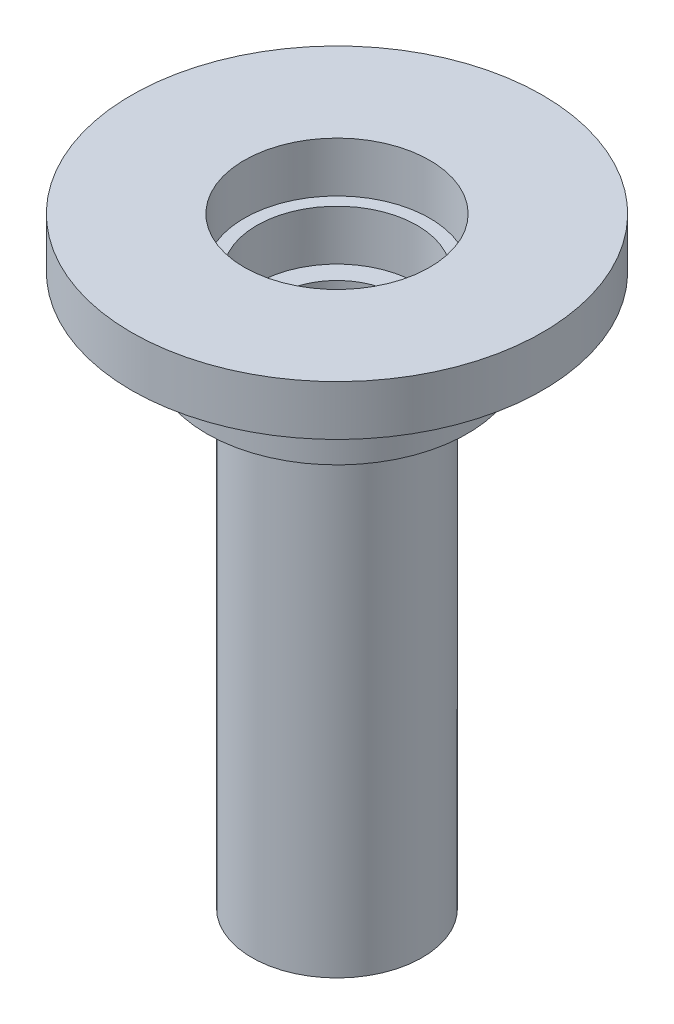
from build123d import *

# Parameters (mm, degrees)
SKETCH3_R      = 18.5
EXTRUDE1_DEPTH = 20
SKETCH4_R      = 14
EXTRUDE2_DEPTH = 14
SKETCH5_R      = 18.5
EXTRUDE3_DEPTH = 10


with BuildPart() as part:
    # Sketch2 → Revolve1 (revolve)
    with BuildSketch(Plane.XY, mode=Mode.PRIVATE) as revolve1_sk:
        Polygon((0, 0), (0, 120), (4, 120), (4, 140), (29, 140), (29, 130), (14, 130), (14, 115), (5, 115), (5, 0), align=None)
    revolve(revolve1_sk.sketch.rotate(Axis((-12, -9.379740318, 0), (0, 1, 0)), 90), axis=Axis((-12, -9.379740318, 0), (0, 1, 0)))

    # Sketch3 → Extrude1 (cut)
    with BuildSketch(Plane.XZ):
        with Locations((-12, 0)):
            Circle(SKETCH3_R)
    extrude(amount=-EXTRUDE1_DEPTH, mode=Mode.SUBTRACT)

    # Sketch4 → Extrude2 (cut)
    with BuildSketch(Plane.XZ.offset(-20)):
        with Locations(Location((-12, 0, 0), (0, 0, 270))):
            Circle(SKETCH4_R)
    extrude(amount=-EXTRUDE2_DEPTH, mode=Mode.SUBTRACT)

    # Sketch5 → Extrude3 (cut)
    with BuildSketch(Plane(origin=(0, 140, 0), x_dir=(1, 0, 0), z_dir=(0, 1, 0))):
        with Locations(Location((-12, 0, 0), (0, 0, 270))):
            Circle(SKETCH5_R)
    extrude(amount=-EXTRUDE3_DEPTH, mode=Mode.SUBTRACT)


solid = part.part
